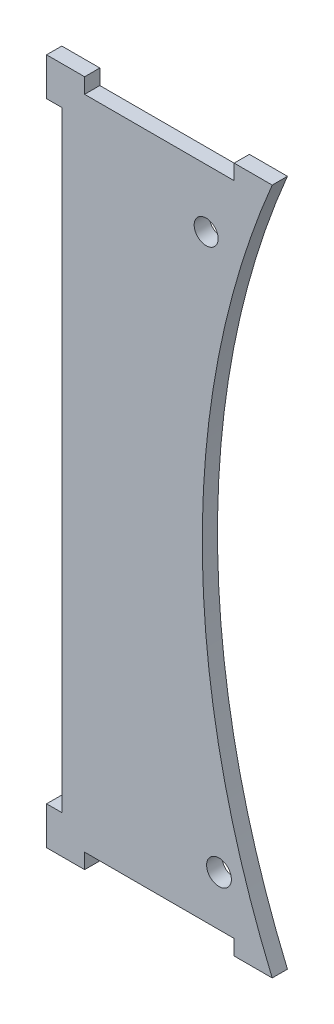
from build123d import *

# Parameters (mm, degrees)
SKETCH1_R           = 4.136999592
SKETCH1_R_2         = 4
BOSS_EXTRUDE1_DEPTH = 5.08


with BuildPart() as part:
    # Sketch1 → Boss-Extrude1 (new body)
    with BuildSketch(Plane.XY):
        with BuildLine():
            Line((-1.053755041, -250.411017633), (-6.133755041, -250.411017633))
            Line((-6.133755041, -250.411017633), (-6.133755041, -263.111017633))
            Line((-6.133755041, -263.111017633), (6.566244959, -263.111017633))
            Line((6.566244959, -263.111017633), (6.566244959, -258.031017633))
            Line((6.566244959, -258.031017633), (56.490143771, -258.031017633))
            Line((56.490143771, -258.031017633), (56.490143771, -263.111017633))
            Line((56.490143771, -263.111017633), (69.190143771, -263.111017633))
            ThreePointArc((69.190143771, -263.111017633), (45.84381153, -148.493633523), (69.190143771, -33.876249413))
            Line((69.190143771, -33.876249413), (56.490143771, -33.876249413))
            Line((56.490143771, -33.876249413), (56.490143771, -38.956249413))
            Line((56.490143771, -38.956249413), (6.566244959, -38.956249413))
            Line((6.566244959, -38.956249413), (6.566244959, -33.876249413))
            Line((6.566244959, -33.876249413), (-6.133755041, -33.876249413))
            Line((-6.133755041, -33.876249413), (-6.133755041, -46.576249413))
            Line((-6.133755041, -46.576249413), (-1.053755041, -46.576249413))
            Line((-1.053755041, -46.576249413), (-1.053755041, -250.411017633))
        make_face()
        with Locations((51.42519067, -241.419788328)):
            Circle(SKETCH1_R, mode=Mode.SUBTRACT)
        with Locations((47.132064803, -58.435465331)):
            Circle(SKETCH1_R_2, mode=Mode.SUBTRACT)
    extrude(amount=BOSS_EXTRUDE1_DEPTH)


solid = part.part
